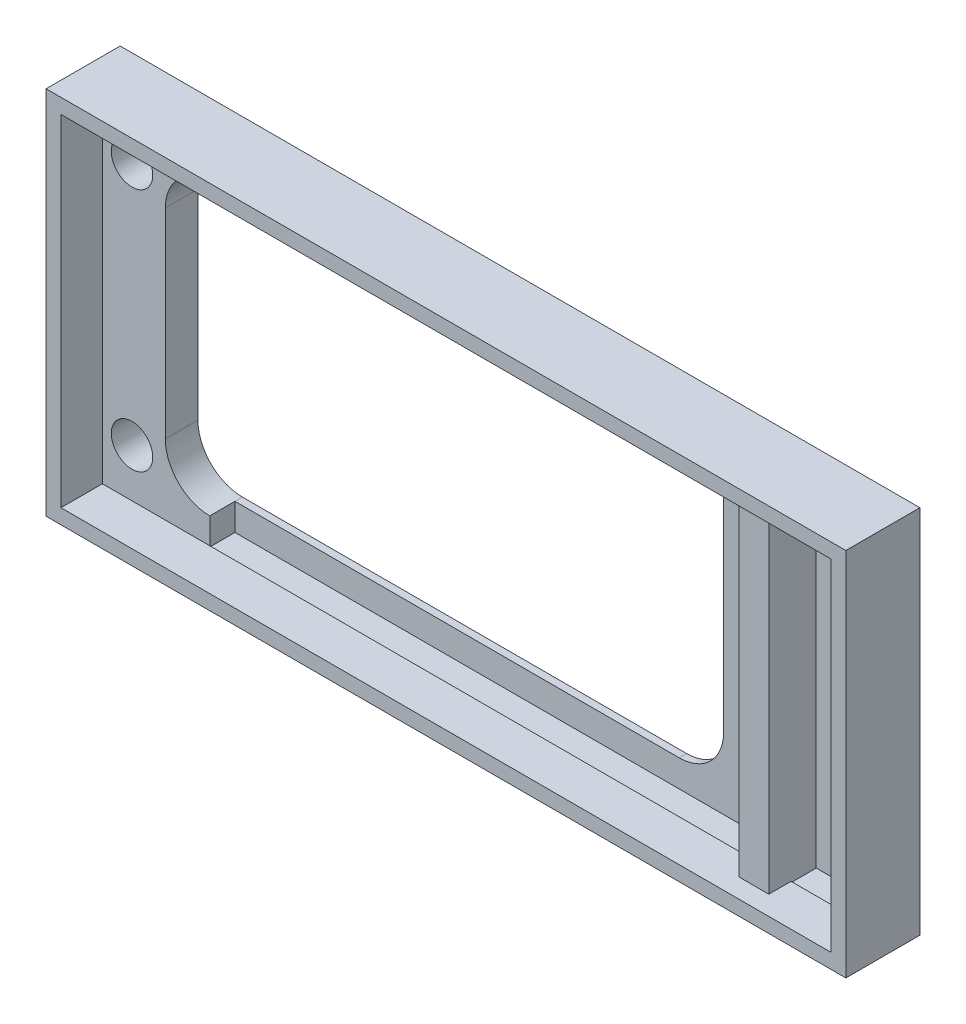
from build123d import *

# Parameters (mm, degrees)
SKETCH1_W           = 54
SKETCH1_H           = 25
SKETCH1_W_2         = 52
SKETCH1_H_2         = 23
BOSS_EXTRUDE1_DEPTH = 5
SKETCH2_W           = 54
SKETCH2_H           = 25
SKETCH2_R           = 1.4
BOSS_EXTRUDE2_DEPTH = 2.2
SKETCH3_W           = 44.75
SKETCH3_H           = 23.07193706
CUT_EXTRUDE1_DEPTH  = 1.7
FILLET1_R           = 1
SKETCH5_W           = 2
SKETCH5_H           = 23.07193706
BOSS_EXTRUDE3_DEPTH = 3.2


with BuildPart() as part:
    # Sketch1 → Boss-Extrude1 (new body)
    with BuildSketch(Plane.XY):
        Rectangle(SKETCH1_W, SKETCH1_H)
        Rectangle(SKETCH1_W_2, SKETCH1_H_2, mode=Mode.SUBTRACT)
    extrude(amount=BOSS_EXTRUDE1_DEPTH)

    # Sketch2 → Boss-Extrude2 (add)
    with BuildSketch(Plane(origin=(0, 0, 0), x_dir=(-1, 0, 0), z_dir=(0, 0, -1))):
        Rectangle(SKETCH2_W, SKETCH2_H)
        with Locations((24, 8.25)):
            Circle(SKETCH2_R, mode=Mode.SUBTRACT)
        with Locations((24, -8.25)):
            Circle(SKETCH2_R, mode=Mode.SUBTRACT)
        with Locations((-23, 8.25)):
            Circle(SKETCH2_R, mode=Mode.SUBTRACT)
        with Locations((-23, -8.25)):
            Circle(SKETCH2_R, mode=Mode.SUBTRACT)
        with BuildLine():
            Line((-11.25, -9.75), (18.75, -9.75))
            ThreePointArc((18.75, -9.75), (20.871320344, -8.871320344), (21.75, -6.75))
            Line((21.75, -6.75), (21.75, 6.75))
            ThreePointArc((21.75, 6.75), (20.871320344, 8.871320344), (18.75, 9.75))
            Line((18.75, 9.75), (-11.25, 9.75))
            ThreePointArc((-11.25, 9.75), (-13.371320344, 8.871320344), (-14.25, 6.75))
            Line((-14.25, 6.75), (-14.25, -6.75))
            ThreePointArc((-14.25, -6.75), (-13.371320344, -8.871320344), (-11.25, -9.75))
        make_face(mode=Mode.SUBTRACT)
    extrude(amount=-BOSS_EXTRUDE2_DEPTH)

    # Sketch3 → Cut-Extrude1 (cut)
    with BuildSketch(Plane.XY.offset(2.2)):
        with Locations((3.625, -0.03596853)):
            Rectangle(SKETCH3_W, SKETCH3_H)
    extrude(amount=-CUT_EXTRUDE1_DEPTH, mode=Mode.SUBTRACT)

    # Fillet1
    fillet1_edges = [part.edges().sort_by_distance(p)[0] for p in [
        (-18.75, 10.625, 2.2),
    ]]
    fillet(fillet1_edges, radius=FILLET1_R)

    # Sketch5 → Boss-Extrude3 (add)
    with BuildSketch(Plane.XY.offset(0.5)):
        with Locations((19.5, -0.03596853)):
            Rectangle(SKETCH5_W, SKETCH5_H)
    extrude(amount=BOSS_EXTRUDE3_DEPTH)


solid = part.part
